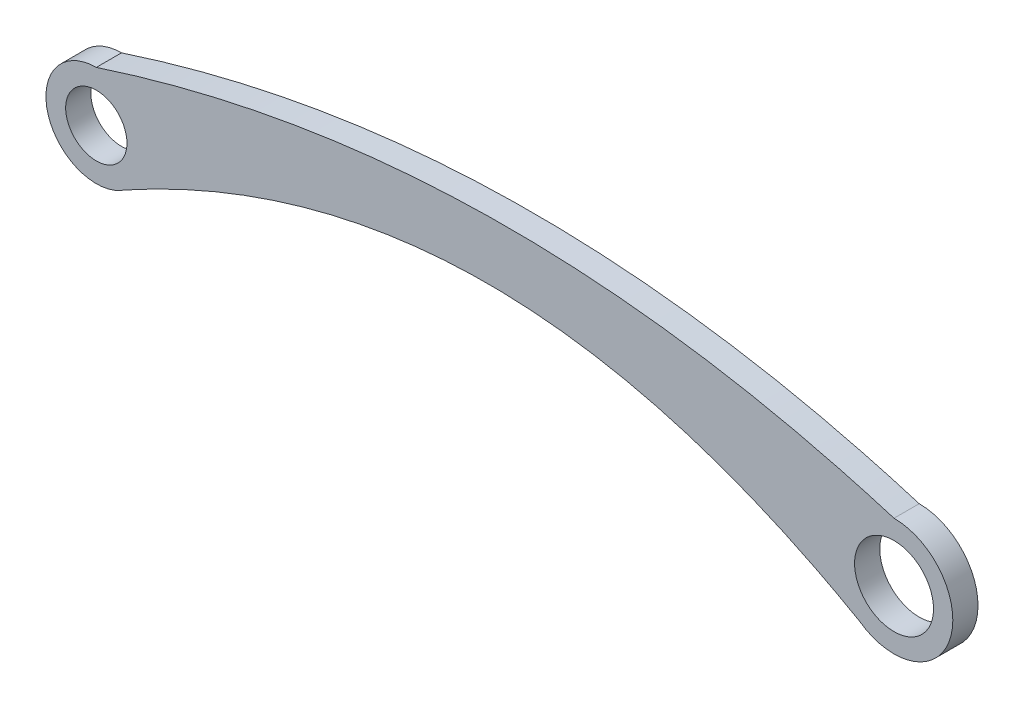
from build123d import *

# Parameters (mm, degrees)
SKETCH_1_R      = 3.65
SKETCH_1_R_2    = 4.7
EXTRUDE_3_DEPTH = 3


with BuildPart() as part:
    # 草图1 → 凸台-拉伸3 (new body)
    with BuildSketch(Plane.XY):
        with BuildLine():
            ThreePointArc((90.926795434, 1.307109296), (101.665216985, 4.861102495), (95, 14))
            add(Edge.make_bspline(
                [(95, 14), (47.345961789, 28.498417982), (0, 13)],
                knots=[0.500810725, 0.500810725, 0.500810725, 1.500810725, 1.500810725, 1.500810725], degree=2))
            ThreePointArc((0, 13), (-5.732365711, 5.228000182), (3.385916999, 2.046661118))
            add(Edge.make_bspline(
                [(3.385916999, 2.046661118), (47.399803665, 26.327498122), (90.926795434, 1.307109296)],
                knots=[0, 0, 0, 1, 1, 1], degree=2))
        make_face()
        with Locations((0, 7)):
            Circle(SKETCH_1_R, mode=Mode.SUBTRACT)
        with Locations((95, 7)):
            Circle(SKETCH_1_R_2, mode=Mode.SUBTRACT)
    extrude(amount=EXTRUDE_3_DEPTH)


solid = part.part
